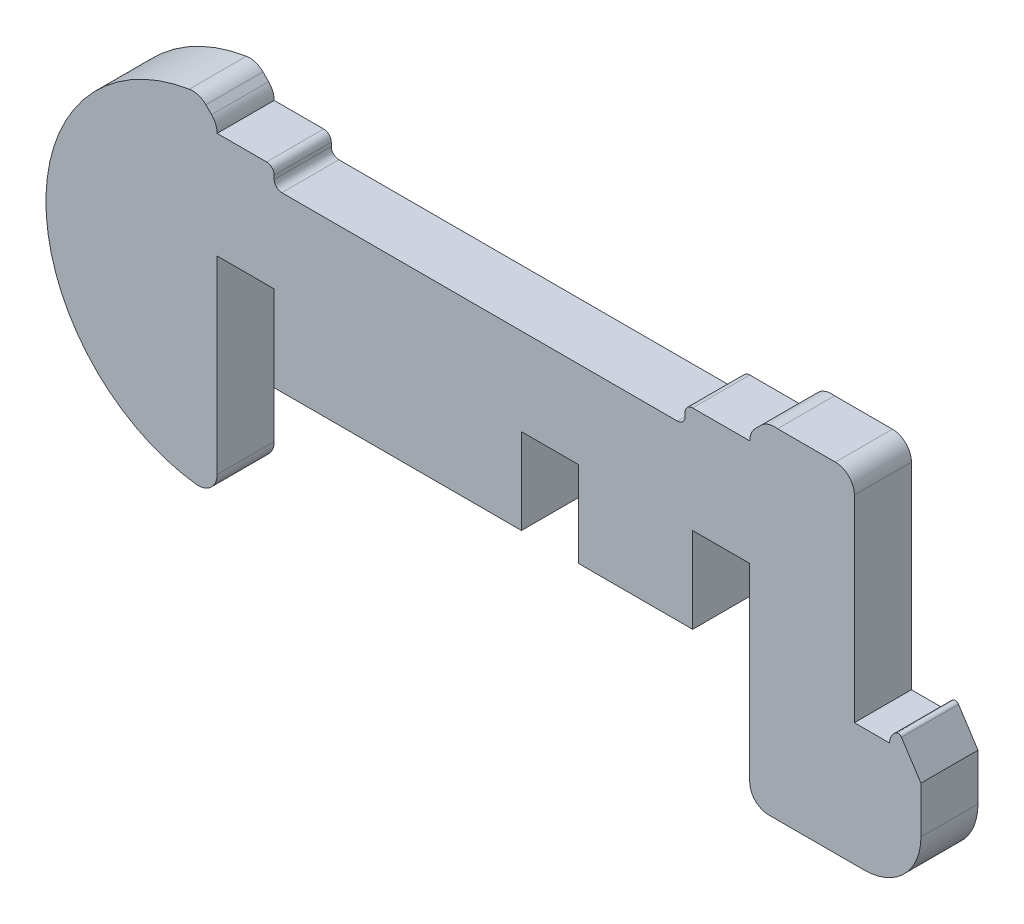
from build123d import *

# Parameters (mm, degrees)
SALIENTE_EXTRUIR1_DEPTH = 3


with BuildPart() as part:
    # Model → Saliente-Extruir1 (new body)
    with BuildSketch(Plane.XY):
        with BuildLine():
            Line((47.379734173, 293.880494369), (50.419280292, 293.880494369))
            ThreePointArc((50.419280292, 293.880494369), (51.126387073, 293.58760115), (51.419280292, 292.880494369))
            Line((51.419280292, 292.880494369), (51.419280292, 282.514242123))
            Line((51.419280292, 282.514242123), (53.269280292, 282.514242123))
            ThreePointArc((53.269280292, 282.514242123), (53.363243785, 282.877719909), (53.621589895, 283.150121316))
            ThreePointArc((53.621589895, 283.150121316), (53.770849393, 283.175830273), (53.895329391, 283.089551201))
            Line((53.895329391, 283.089551201), (54.919280292, 281.514242123))
            Line((54.919280292, 281.514242123), (54.919280292, 279.062526812))
            ThreePointArc((54.919280292, 279.062526812), (54.040600635, 276.941206469), (51.919280292, 276.062526812))
            Line((51.919280292, 276.062526812), (46.919280292, 276.062526812))
            ThreePointArc((46.919280292, 276.062526812), (46.212173511, 276.355420031), (45.919280292, 277.062526812))
            Line((45.919280292, 277.062526812), (45.919280292, 287.014242123))
            Line((45.919280292, 287.014242123), (42.919280292, 287.014242123))
            Line((42.919280292, 287.014242123), (42.919280292, 282.514242123))
            Line((42.919280292, 282.514242123), (36.919280292, 282.514242123))
            Line((36.919280292, 282.514242123), (36.919280292, 287.014242123))
            Line((36.919280292, 287.014242123), (33.919280292, 287.014242123))
            Line((33.919280292, 287.014242123), (33.919280292, 282.514242123))
            Line((33.919280292, 282.514242123), (20.919280292, 282.514242123))
            Line((20.919280292, 282.514242123), (20.919280292, 287.014242123))
            Line((20.919280292, 287.014242123), (17.919280292, 287.014242123))
            Line((17.919280292, 287.014242123), (17.919280292, 277.062526812))
            ThreePointArc((17.919280292, 277.062526812), (17.58071812, 276.312526812), (16.794280292, 276.070370071))
            ThreePointArc((16.794280292, 276.070370071), (8.920876277, 284.83029571), (16.458826411, 293.880494369))
            ThreePointArc((16.458826411, 293.880494369), (16.927302549, 293.845714495), (17.328205845, 293.600855192))
            Line((17.328205845, 293.600855192), (17.626387073, 293.302673965))
            ThreePointArc((17.626387073, 293.302673965), (17.843159824, 292.978250616), (17.919280292, 292.595567183))
            Line((17.919280292, 292.595567183), (20.519280292, 292.595567183))
            ThreePointArc((20.519280292, 292.595567183), (20.802123004, 292.478409896), (20.919280292, 292.195567183))
            Line((20.919280292, 292.195567183), (20.919280292, 291.995567183))
            ThreePointArc((20.919280292, 291.995567183), (21.036437579, 291.712724471), (21.319280292, 291.595567183))
            Line((21.319280292, 291.595567183), (42.119280292, 291.595567183))
            ThreePointArc((42.119280292, 291.595567183), (42.402123004, 291.712724471), (42.519280292, 291.995567183))
            Line((42.519280292, 291.995567183), (42.519280292, 292.195567183))
            ThreePointArc((42.519280292, 292.195567183), (42.636437579, 292.478409896), (42.919280292, 292.595567183))
            Line((42.919280292, 292.595567183), (45.919280292, 292.595567183))
            ThreePointArc((45.919280292, 292.595567183), (45.995400759, 292.978250616), (46.212173511, 293.302673965))
            Line((46.212173511, 293.302673965), (46.510354738, 293.600855192))
            ThreePointArc((46.510354738, 293.600855192), (46.911258035, 293.845714495), (47.379734173, 293.880494369))
        make_face()
    extrude(amount=SALIENTE_EXTRUIR1_DEPTH)


solid = part.part
